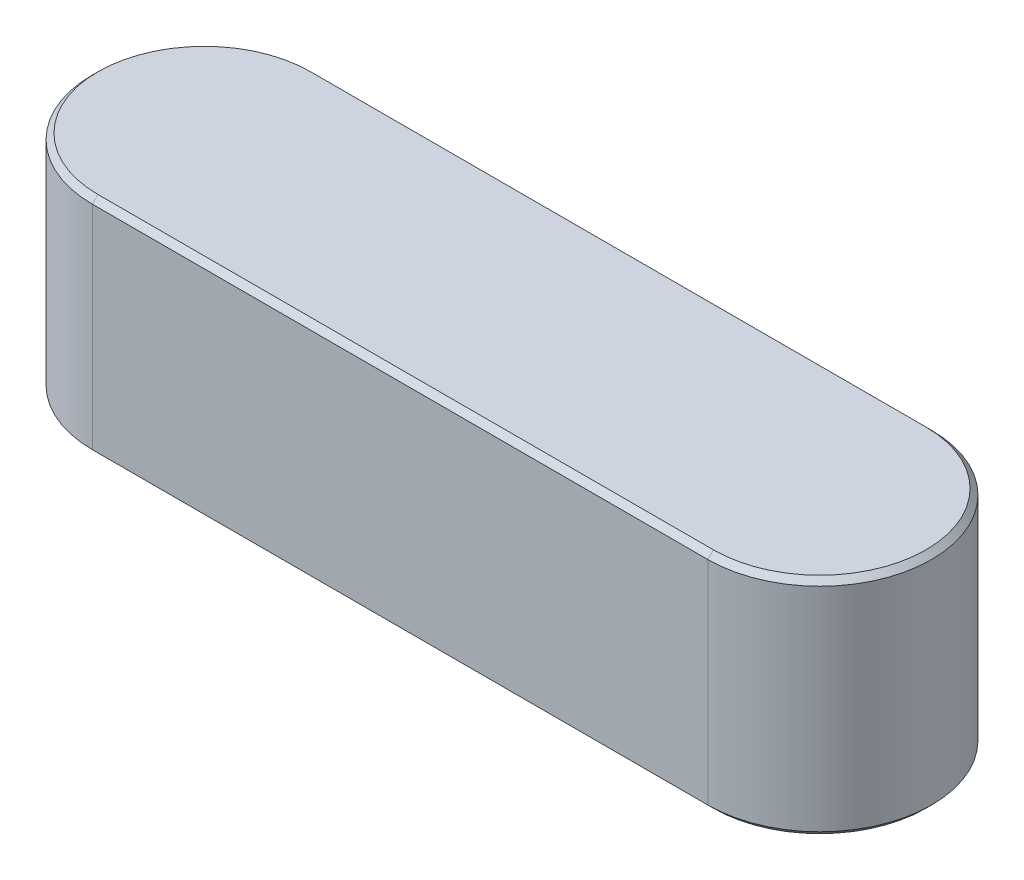
from build123d import *

# Parameters (mm, degrees)
BOSS_EXTRU_1_DEPTH = 4
CHANFREIN1_SIZE    = 0.1


with BuildPart() as part:
    # Esquisse1 → Boss.-Extru.1 (new body)
    with BuildSketch(Plane(origin=(0, 0, 0), x_dir=(1, 0, 0), z_dir=(0, 1, 0))):
        with BuildLine():
            Line((-5.5, 2), (5.5, 2))
            ThreePointArc((5.5, 2), (7.5, 0), (5.5, -2))
            Line((5.5, -2), (-5.5, -2))
            ThreePointArc((-5.5, -2), (-7.5, 0), (-5.5, 2))
        make_face()
    extrude(amount=BOSS_EXTRU_1_DEPTH)

    # Chanfrein1
    chanfrein1_edges = [part.edges().sort_by_distance(p)[0] for p in [
        (7.5, 4, 0),
        (0, 4, -2),
        (-7.5, 4, 0),
        (0, 0, -2),
        (7.5, 0, 0),
        (0, 0, 2),
        (-7.5, 0, 0),
        (0, 4, 2),
    ]]
    chamfer(chanfrein1_edges, length=CHANFREIN1_SIZE)


solid = part.part
